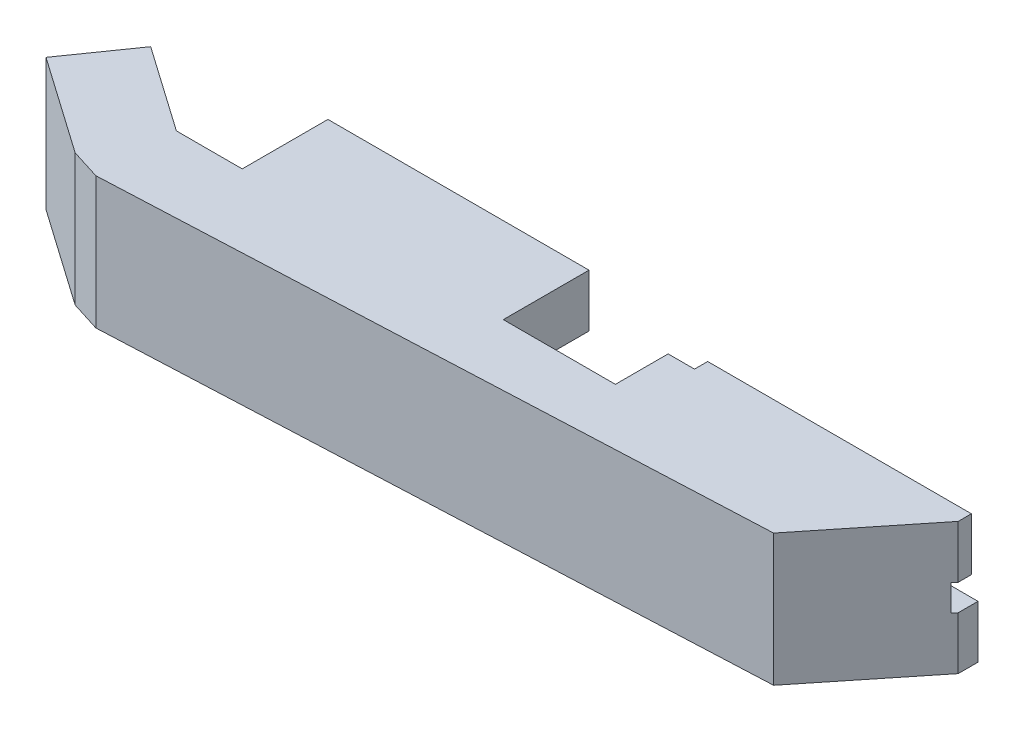
from build123d import *

# Parameters (mm, degrees)
BOSS_EXTRUDE1_DEPTH = 4
BOSS_EXTRUDE3_DEPTH = 2
BOSS_EXTRUDE4_DEPTH = 4
BOSS_EXTRUDE5_DEPTH = 2
BOSS_EXTRUDE6_DEPTH = 4


with BuildPart() as part:
    # Sketch1 → Boss-Extrude1 (new body)
    with BuildSketch(Plane(origin=(0, 0, 0), x_dir=(1, 0, 0), z_dir=(0, 1, 0))):
        with BuildLine():
            Line((-14.545827973, 6.554746402), (-17.81521366, 1.88557975))
            Line((-17.81521366, 1.88557975), (-10.442845262, -3.276608177))
            Line((-10.442845262, -3.276608177), (-8.148539516, -4))
            Line((-8.148539516, -4), (41.019227437, -1.767766953))
            Line((41.019227437, -1.767766953), (39.551460484, -0.3))
            Line((39.551460484, -0.3), (39.551460484, 4.117528082))
            ThreePointArc((39.551460484, 4.117528082), (40.137246921, 5.114213562), (41.133932401, 5.7))
            Line((41.133932401, 5.7), (47.010764551, 5.7))
            Line((47.010764551, 5.7), (47.251460484, 6))
            Line((47.251460484, 6), (47.251460484, 7))
            Line((47.251460484, 7), (27.251460484, 7))
            Line((27.251460484, 7), (27.251460484, 6))
            Line((27.251460484, 6), (25.251460484, 6))
            Line((25.251460484, 6), (25.251460484, 2))
            Line((25.251460484, 2), (16.751460484, 2))
            Line((16.751460484, 2), (16.751460484, 8.5))
            Line((16.751460484, 8.5), (-3.048539516, 8.5))
            Line((-3.048539516, 8.5), (-3.048539516, 2))
            Line((-3.048539516, 2), (-8.040975977, 2))
            Line((-8.040975977, 2), (-14.545827973, 6.554746402))
        make_face()
    extrude(amount=BOSS_EXTRUDE1_DEPTH)

    # Sketch1<7> → Boss-Extrude3 (add)
    with BuildSketch(Plane(origin=(0, 0, 0), x_dir=(1, 0, 0), z_dir=(0, 1, 0))):
        with BuildLine():
            ThreePointArc((10.010184156, 0.607136774), (5.101460484, 4.199275448), (0.192736812, 0.607136774))
            Line((0.192736812, 0.607136774), (0.192736812, -0.3))
            Line((0.192736812, -0.3), (-8.243129153, -0.3))
            Line((-8.243129153, -0.3), (-15.692980846, 4.916442314))
            Line((-15.692980846, 4.916442314), (-17.81521366, 1.88557975))
            Line((-17.81521366, 1.88557975), (-10.442845262, -3.276608177))
            Line((-10.442845262, -3.276608177), (-8.148539516, -4))
            Line((-8.148539516, -4), (41.019227437, -1.767766953))
            Line((41.019227437, -1.767766953), (39.551460484, -0.3))
            Line((39.551460484, -0.3), (39.251460484, -0.3))
            Line((39.251460484, -0.3), (39.051460484, -0.3))
            Line((39.051460484, -0.3), (10.010184156, -0.3))
            Line((10.010184156, -0.3), (10.010184156, 0.607136774))
        make_face()
    extrude(amount=-BOSS_EXTRUDE3_DEPTH)

    # Sketch1<8> → Boss-Extrude4 (add)
    with BuildSketch(Plane(origin=(0, 0, 0), x_dir=(1, 0, 0), z_dir=(0, 1, 0))):
        with BuildLine():
            Line((39.551460484, 0), (39.551460484, -0.3))
            Line((39.551460484, -0.3), (41.019227437, -1.767766953))
            Line((41.019227437, -1.767766953), (47.010764551, 5.7))
            Line((47.010764551, 5.7), (41.133932401, 5.7))
            ThreePointArc((41.133932401, 5.7), (40.598184056, 5.470750493), (40.137246921, 5.114213562))
            ThreePointArc((40.137246921, 5.114213562), (39.780709991, 4.653276427), (39.551460484, 4.117528082))
            Line((39.551460484, 4.117528082), (39.551460484, 0))
        make_face()
    extrude(amount=BOSS_EXTRUDE4_DEPTH)

    # Sketch1<9> → Boss-Extrude5 (add)
    with BuildSketch(Plane(origin=(0, 0, 0), x_dir=(1, 0, 0), z_dir=(0, 1, 0))):
        with BuildLine():
            Line((39.551460484, 0), (39.551460484, -0.3))
            Line((39.551460484, -0.3), (41.019227437, -1.767766953))
            Line((41.019227437, -1.767766953), (47.010764551, 5.7))
            Line((47.010764551, 5.7), (41.133932401, 5.7))
            ThreePointArc((41.133932401, 5.7), (40.598184056, 5.470750493), (40.137246921, 5.114213562))
            ThreePointArc((40.137246921, 5.114213562), (39.780709991, 4.653276427), (39.551460484, 4.117528082))
            Line((39.551460484, 4.117528082), (39.551460484, 0))
        make_face()
    extrude(amount=-BOSS_EXTRUDE5_DEPTH)

    # Sketch2 → Boss-Extrude6 (add)
    with BuildSketch(Plane(origin=(0, -2, 0), x_dir=(-1, 0, 0), z_dir=(0, -1, 0))):
        Polygon((-47.251460484, 7), (-47.251460484, 6), (-41.019227437, -1.767766953), (8.148539516, -4), (10.442845262, -3.276608177), (17.81521366, 1.88557975), (15.692980846, 4.916442314), (15.520907915, 5.162187927), (14.545827973, 6.554746402), (14.373755042, 6.800492016), (9.40586076, 3.32193499), (7.517941939, 2), (6.803867935, 1.5), (2.548539516, 1.5), (2.548539516, 7.5), (-16.751460484, 7.5), (-24.751460484, 7.5), (-24.751460484, 4.5), (-28.638302621, 4.5), (-33.251460484, 4.5), (-33.251460484, 7.5), (-37.214164404, 7.5), (-47.251460484, 7.5), align=None)
    extrude(amount=BOSS_EXTRUDE6_DEPTH)


solid = part.part
